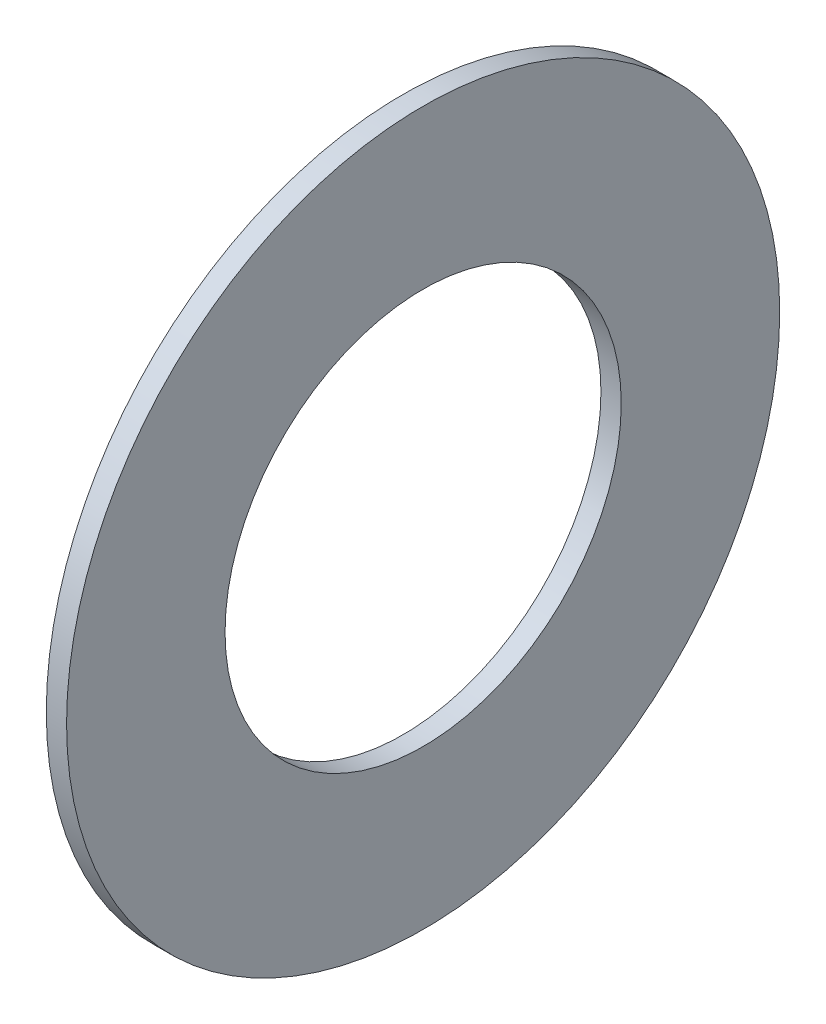
from build123d import *

# Parameters (mm, degrees)
SKETCH1_R      = 14.2875
SKETCH1_R_2    = 7.9375
EXTRUDE1_DEPTH = 0.8128


with BuildPart() as part:
    # Sketch1 → Extrude1 (new body)
    with BuildSketch(Plane(origin=(0, 0, 0), x_dir=(0, 0, -1), z_dir=(1, 0, 0))):
        Circle(SKETCH1_R)
        Circle(SKETCH1_R_2, mode=Mode.SUBTRACT)
    extrude(amount=EXTRUDE1_DEPTH)


solid = part.part
